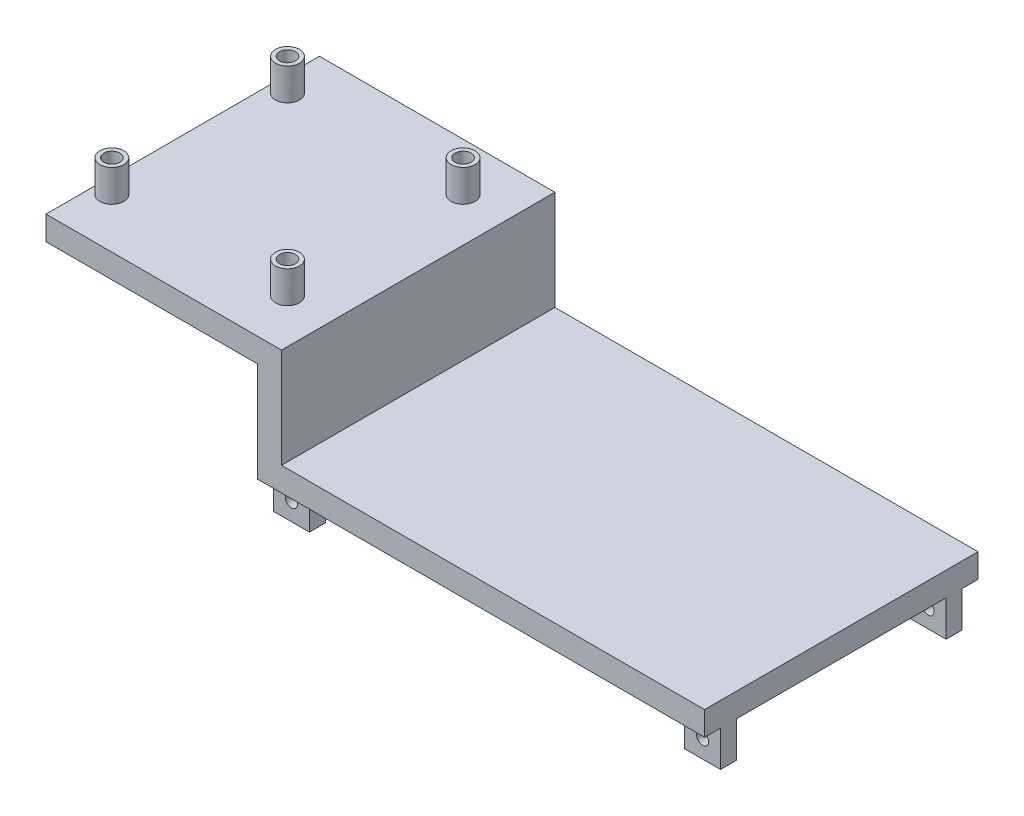
from build123d import *

# Parameters (mm, degrees)
SKETCH1_W               = 112
SKETCH1_H               = 34.25
BOSS_EXTRUDE2_DEPTH     = 6
SKETCH3_W               = 9
SKETCH3_H               = 4
BOSS_EXTRUDE3_DEPTH     = 9
SKETCH4_R               = 1.5
CUT_EXTRUDE1_DEPTH      = 117.361774222
SKETCH8_W               = 6
SKETCH8_H               = 34.25
BOSS_EXTRUDE6_DEPTH     = 25
SKETCH9_W               = 34.25
SKETCH9_H               = 6
BOSS_EXTRUDE7_DEPTH     = 53
CUT_EXTRUDE5_DEPTH      = 8
CUT_EXTRUDE5_DEPTH_BACK = 184.077169521
SKETCH10_R              = 2
BOSS_EXTRUDE8_START     = 8
SKETCH12_R              = 3
SKETCH12_R_2            = 2
BOSS_EXTRUDE8_DEPTH     = 8


with BuildPart() as part:
    # Sketch1 → Boss-Extrude2 (new body)
    with BuildSketch(Plane(origin=(0, 0, 0), x_dir=(1, 0, 0), z_dir=(0, 1, 0))):
        with Locations((-56, 17.125)):
            Rectangle(SKETCH1_W, SKETCH1_H)
    boss_extrude2 = extrude(amount=BOSS_EXTRUDE2_DEPTH)

    # Sketch3 → Boss-Extrude3 (add)
    with BuildSketch(Plane.XZ):
        with Locations((-107.5, -6)):
            Rectangle(SKETCH3_W, SKETCH3_H)
        with Locations((-4.5, -6)):
            Rectangle(SKETCH3_W, SKETCH3_H)
    boss_extrude3 = extrude(amount=BOSS_EXTRUDE3_DEPTH)

    # Sketch4 → Cut-Extrude1 (cut, through all)
    with BuildSketch(Plane.XY.offset(-4)):
        with Locations((-107.5, -4.5)):
            Circle(SKETCH4_R)
        with Locations((-4.5, -4.5)):
            Circle(SKETCH4_R)
    cut_extrude1 = extrude(amount=-CUT_EXTRUDE1_DEPTH, mode=Mode.SUBTRACT)

    # Sketch8 → Boss-Extrude6 (add)
    with BuildSketch(Plane(origin=(0, 6, 0), x_dir=(1, 0, 0), z_dir=(0, 1, 0))):
        with Locations((-109, 17.125)):
            Rectangle(SKETCH8_W, SKETCH8_H)
    boss_extrude6 = extrude(amount=BOSS_EXTRUDE6_DEPTH)

    # Sketch9 → Boss-Extrude7 (add)
    with BuildSketch(Plane.ZY.offset(112)):
        with Locations((-17.125, 28)):
            Rectangle(SKETCH9_W, SKETCH9_H)
    boss_extrude7 = extrude(amount=BOSS_EXTRUDE7_DEPTH)

    # Mirror2: Boss-Extrude2, Boss-Extrude3, Cut-Extrude1, Boss-Extrude6, Boss-Extrude7 across plane
    add(boss_extrude2.mirror(Plane(origin=(0, 6, -34.25), x_dir=(1, 0, 0), z_dir=(0, 0, 1))))
    add(boss_extrude3.mirror(Plane(origin=(0, 6, -34.25), x_dir=(1, 0, 0), z_dir=(0, 0, 1))))
    add(cut_extrude1.mirror(Plane(origin=(0, 6, -34.25), x_dir=(1, 0, 0), z_dir=(0, 0, 1))), mode=Mode.SUBTRACT)
    add(boss_extrude6.mirror(Plane(origin=(0, 6, -34.25), x_dir=(1, 0, 0), z_dir=(0, 0, 1))))
    add(boss_extrude7.mirror(Plane(origin=(0, 6, -34.25), x_dir=(1, 0, 0), z_dir=(0, 0, 1))))

    # Sketch10 → Cut-Extrude5 (cut, two sides: drawn at the far end of the back side and taken through both)
    with BuildSketch(Plane(origin=(0, 31, 0), x_dir=(1, 0, 0), z_dir=(0, 1, 0)).offset(-CUT_EXTRUDE5_DEPTH_BACK)):
        with Locations((-161, 12.5)):
            Circle(SKETCH10_R)
        with Locations((-117, 12.5)):
            Circle(SKETCH10_R)
        with Locations((-161, 56.5)):
            Circle(SKETCH10_R)
        with Locations((-117, 56.5)):
            Circle(SKETCH10_R)
    extrude(amount=CUT_EXTRUDE5_DEPTH + CUT_EXTRUDE5_DEPTH_BACK, mode=Mode.SUBTRACT)

    # Sketch12 → Boss-Extrude8 (add)
    # profile 1 of 4: a face of its own
    with BuildSketch(Plane(origin=(0, 31, 0), x_dir=(1, 0, 0), z_dir=(0, 1, 0)).offset(BOSS_EXTRUDE8_START)):
        with Locations((-161, 56.5)):
            Circle(SKETCH12_R)
        with Locations((-161, 56.5)):
            Circle(SKETCH12_R_2, mode=Mode.SUBTRACT)
    # profile 2 of 4: a face of its own
    with BuildSketch(Plane(origin=(0, 31, 0), x_dir=(1, 0, 0), z_dir=(0, 1, 0)).offset(BOSS_EXTRUDE8_START)):
        with Locations((-117, 56.5)):
            Circle(SKETCH12_R)
        with Locations((-117, 56.5)):
            Circle(SKETCH12_R_2, mode=Mode.SUBTRACT)
    # profile 3 of 4: a face of its own
    with BuildSketch(Plane(origin=(0, 31, 0), x_dir=(1, 0, 0), z_dir=(0, 1, 0)).offset(BOSS_EXTRUDE8_START)):
        with Locations((-117, 12.5)):
            Circle(SKETCH12_R)
        with Locations((-117, 12.5)):
            Circle(SKETCH12_R_2, mode=Mode.SUBTRACT)
    # profile 4 of 4: a face of its own
    with BuildSketch(Plane(origin=(0, 31, 0), x_dir=(1, 0, 0), z_dir=(0, 1, 0)).offset(BOSS_EXTRUDE8_START)):
        with Locations((-161, 12.5)):
            Circle(SKETCH12_R)
        with Locations((-161, 12.5)):
            Circle(SKETCH12_R_2, mode=Mode.SUBTRACT)
    extrude(amount=-BOSS_EXTRUDE8_DEPTH)


solid = part.part
